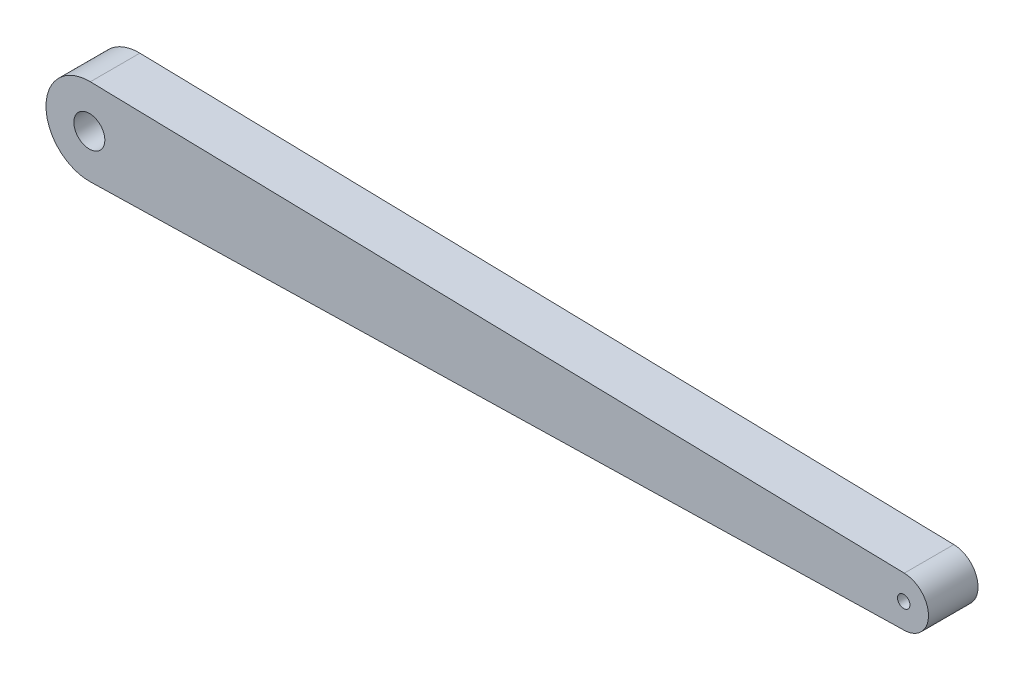
from build123d import *

# Parameters (mm, degrees)
SKETCH1_R           = 25
SKETCH1_R_2         = 10
BOSS_EXTRUDE1_DEPTH = 40


with BuildPart() as part:
    # Sketch1 → Boss-Extrude1 (new, symmetric)
    with BuildSketch(Plane.XY):
        with BuildLine():
            Line((-982.173077727, 79.482228812), (332.14251248, 49.490074215))
            ThreePointArc((332.14251248, 49.490074215), (371.22996609, 9.50048597), (332.142514757, -30.489104501))
            Line((332.142514757, -30.489104501), (-982.173073742, -60.48133394))
            ThreePointArc((-982.173073742, -60.48133394), (-1053.77003391, 9.500445398), (-982.173077727, 79.482228812))
        make_face()
        with Locations((-983.77003391, 9.500447391)):
            Circle(SKETCH1_R, mode=Mode.SUBTRACT)
        with Locations((331.22996609, 9.500484831)):
            Circle(SKETCH1_R_2, mode=Mode.SUBTRACT)
    extrude(amount=BOSS_EXTRUDE1_DEPTH, both=True)


solid = part.part
